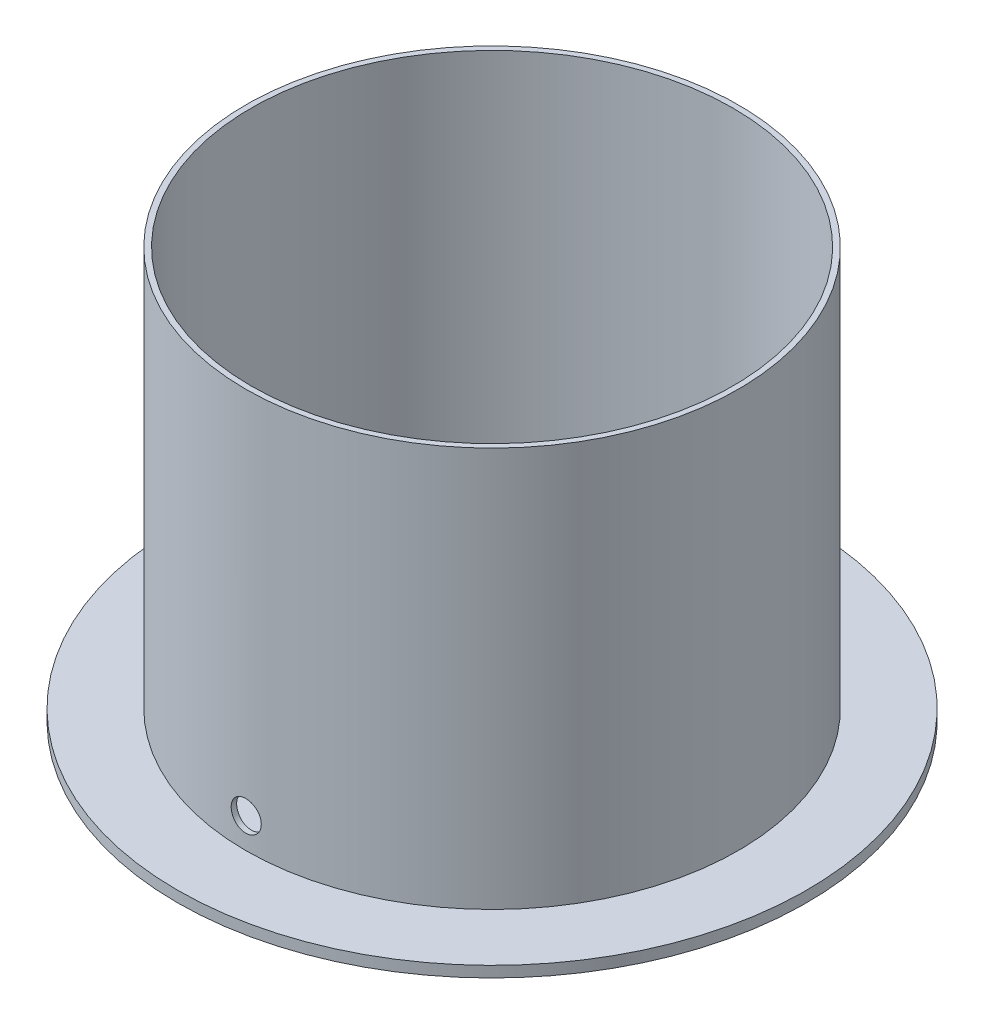
from build123d import *

# Parameters (mm, degrees)
BASE_FLANGE_SKETCH_R       = 230
BASE_FLANGE_DEPTH          = 8
TANK_WALL_SKETCH_R         = 180
TANK_WALL_SKETCH_R_2       = 176
TANK_WALL_DEPTH            = 300
TAP_DRAIN_PORTS_DEPTH      = 443.492937797
TAP_DRAIN_PORTS_DEPTH_BACK = 443.492937797
PORT_HOLES_SKETCH_R        = 11


with BuildPart() as part:
    # Base Flange Sketch → Base Flange (new body)
    with BuildSketch(Plane(origin=(0, 0, 0), x_dir=(1, 0, 0), z_dir=(0, 1, 0))):
        with Locations(Location((0, 0, 0), (0, 0, 270))):
            Circle(BASE_FLANGE_SKETCH_R)
    extrude(amount=BASE_FLANGE_DEPTH)

    # Tank Wall Sketch → Tank Wall (add)
    with BuildSketch(Plane(origin=(0, 0, 0), x_dir=(1, 0, 0), z_dir=(0, 1, 0))):
        with Locations(Location((0, 0, 0), (0, 0, 270))):
            Circle(TANK_WALL_SKETCH_R)
        with Locations(Location((0, 0, 0), (0, 0, 270))):
            Circle(TANK_WALL_SKETCH_R_2, mode=Mode.SUBTRACT)
    extrude(amount=TANK_WALL_DEPTH)

    # Port Holes Sketch → Tap + Drain Ports (cut, two sides: drawn at the far end of the back side and taken through both)
    with BuildSketch(Plane.XY.offset(-TAP_DRAIN_PORTS_DEPTH_BACK)):
        with Locations((0, 30)):
            Circle(PORT_HOLES_SKETCH_R)
    extrude(amount=TAP_DRAIN_PORTS_DEPTH + TAP_DRAIN_PORTS_DEPTH_BACK, mode=Mode.SUBTRACT)


solid = part.part
